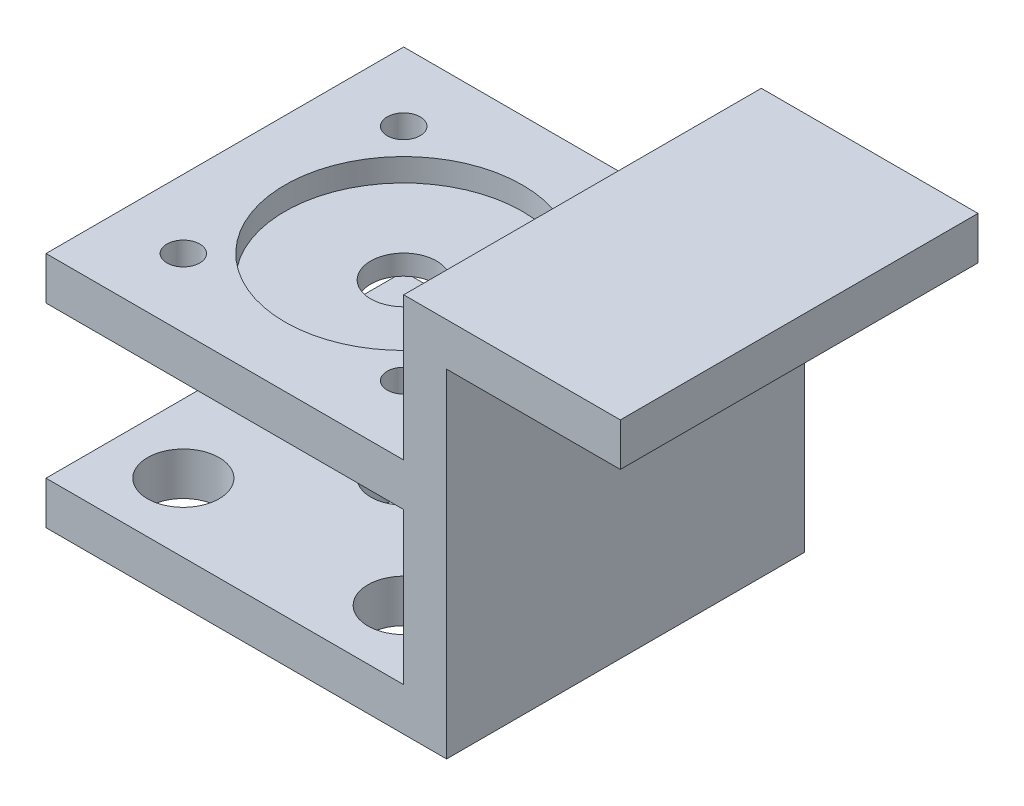
from build123d import *

# Parameters (mm, degrees)
SKETCH1_R           = 1.15
BOSS_EXTRUDE1_DEPTH = 3
SKETCH2_W           = 3
SKETCH2_H           = 25
BOSS_EXTRUDE2_DEPTH = 7
SKETCH3_W           = 15.143900966
SKETCH3_H           = 25
BOSS_EXTRUDE3_DEPTH = 3
SKETCH4_R           = 8.3
CUT_EXTRUDE1_DEPTH  = 1.6
SKETCH5_R           = 2.3
CUT_EXTRUDE2_DEPTH  = 33.480690581
SKETCH6_W           = 3
SKETCH6_H           = 25
BOSS_EXTRUDE4_DEPTH = 10.6
SKETCH7_W           = 28
SKETCH7_H           = 25
SKETCH7_R           = 2.3
SKETCH7_R_2         = 2.5
BOSS_EXTRUDE5_DEPTH = 3


with BuildPart() as part:
    # Sketch1 → Boss-Extrude1 (new body)
    with BuildSketch(Plane(origin=(0, 0, 0), x_dir=(1, 0, 0), z_dir=(0, 1, 0))):
        Polygon((12.5, 12.5), (-12.5, 12.5), (-12.5, -12.5), (12.5, -12.5), (15.5, -12.5), (15.5, 12.5), align=None)
        with Locations(Location((-7.7, 7.7, 0), (0, 0, 270))):
            Circle(SKETCH1_R, mode=Mode.SUBTRACT)
        with Locations(Location((-7.7, -7.7, 0), (0, 0, 270))):
            Circle(SKETCH1_R, mode=Mode.SUBTRACT)
        with Locations(Location((7.7, -7.7, 0), (0, 0, 270))):
            Circle(SKETCH1_R, mode=Mode.SUBTRACT)
        with Locations(Location((7.7, 7.7, 0), (0, 0, 270))):
            Circle(SKETCH1_R, mode=Mode.SUBTRACT)
    extrude(amount=BOSS_EXTRUDE1_DEPTH)

    # Sketch2 → Boss-Extrude2 (add)
    with BuildSketch(Plane(origin=(0, 3, 0), x_dir=(1, 0, 0), z_dir=(0, 1, 0))):
        with Locations((14, 0)):
            Rectangle(SKETCH2_W, SKETCH2_H)
    extrude(amount=BOSS_EXTRUDE2_DEPTH)

    # Sketch3 → Boss-Extrude3 (add)
    with BuildSketch(Plane(origin=(0, 10, 0), x_dir=(1, 0, 0), z_dir=(0, 1, 0))):
        with Locations((20.071950483, 0)):
            Rectangle(SKETCH3_W, SKETCH3_H)
    extrude(amount=BOSS_EXTRUDE3_DEPTH)

    # Sketch4 → Cut-Extrude1 (cut)
    with BuildSketch(Plane(origin=(0, 3, 0), x_dir=(1, 0, 0), z_dir=(0, 1, 0))):
        with Locations(Location((0, 0, 0), (0, 0, 270))):
            Circle(SKETCH4_R)
    extrude(amount=-CUT_EXTRUDE1_DEPTH, mode=Mode.SUBTRACT)

    # Sketch5 → Cut-Extrude2 (cut, through all)
    with BuildSketch(Plane(origin=(0, 1.4, 0), x_dir=(1, 0, 0), z_dir=(0, 1, 0))):
        with Locations(Location((0, 0, 0), (0, 0, 270))):
            Circle(SKETCH5_R)
    extrude(amount=-CUT_EXTRUDE2_DEPTH, mode=Mode.SUBTRACT)

    # Sketch6 → Boss-Extrude4 (add)
    with BuildSketch(Plane.XZ):
        with Locations((14, 0)):
            Rectangle(SKETCH6_W, SKETCH6_H)
    extrude(amount=BOSS_EXTRUDE4_DEPTH)

    # Sketch7 → Boss-Extrude5 (add)
    with BuildSketch(Plane.XZ.offset(10.6)):
        with Locations((1.5, 0)):
            Rectangle(SKETCH7_W, SKETCH7_H)
        with Locations(Location((0, 0, 0), (0, 0, 90))):
            Circle(SKETCH7_R, mode=Mode.SUBTRACT)
        with Locations(Location((-7.7, 7.7, 0), (0, 0, 270))):
            Circle(SKETCH7_R_2, mode=Mode.SUBTRACT)
        with Locations(Location((-7.7, -7.7, 0), (0, 0, 270))):
            Circle(SKETCH7_R_2, mode=Mode.SUBTRACT)
        with Locations(Location((7.7, -7.7, 0), (0, 0, 270))):
            Circle(SKETCH7_R_2, mode=Mode.SUBTRACT)
        with Locations(Location((7.7, 7.7, 0), (0, 0, 270))):
            Circle(SKETCH7_R_2, mode=Mode.SUBTRACT)
    extrude(amount=BOSS_EXTRUDE5_DEPTH)


solid = part.part
